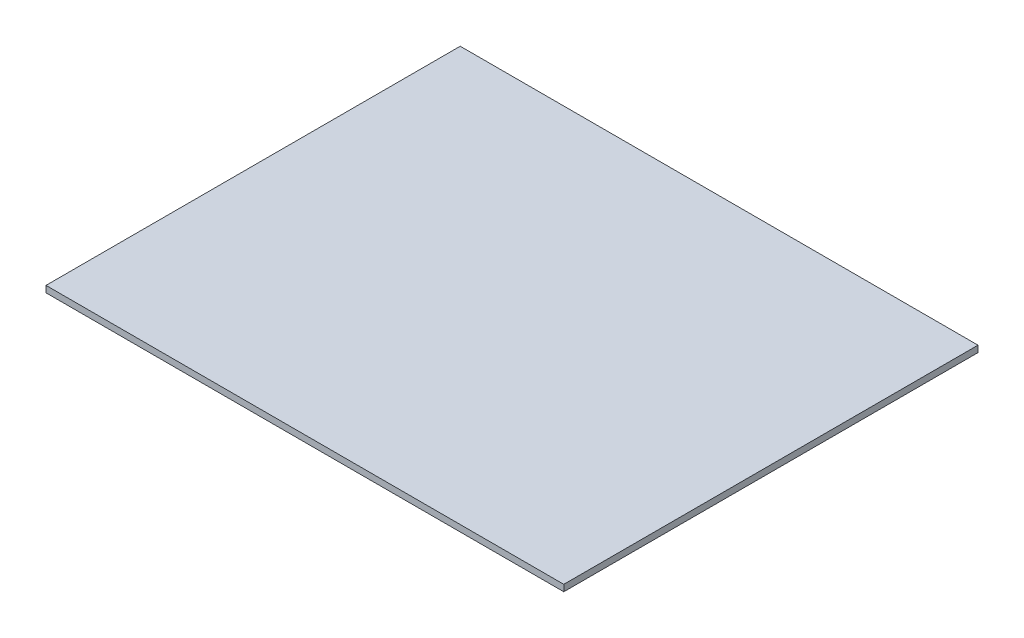
from build123d import *

# Parameters (mm, degrees)
SKETCH2_W           = 762
SKETCH2_H           = 609.6
BOSS_EXTRUDE1_DEPTH = 9.525


with BuildPart() as part:
    # Sketch2 → Boss-Extrude1 (new body)
    with BuildSketch(Plane(origin=(0, 0, 0), x_dir=(1, 0, 0), z_dir=(0, 1, 0))):
        Rectangle(SKETCH2_W, SKETCH2_H)
    extrude(amount=BOSS_EXTRUDE1_DEPTH)


solid = part.part
